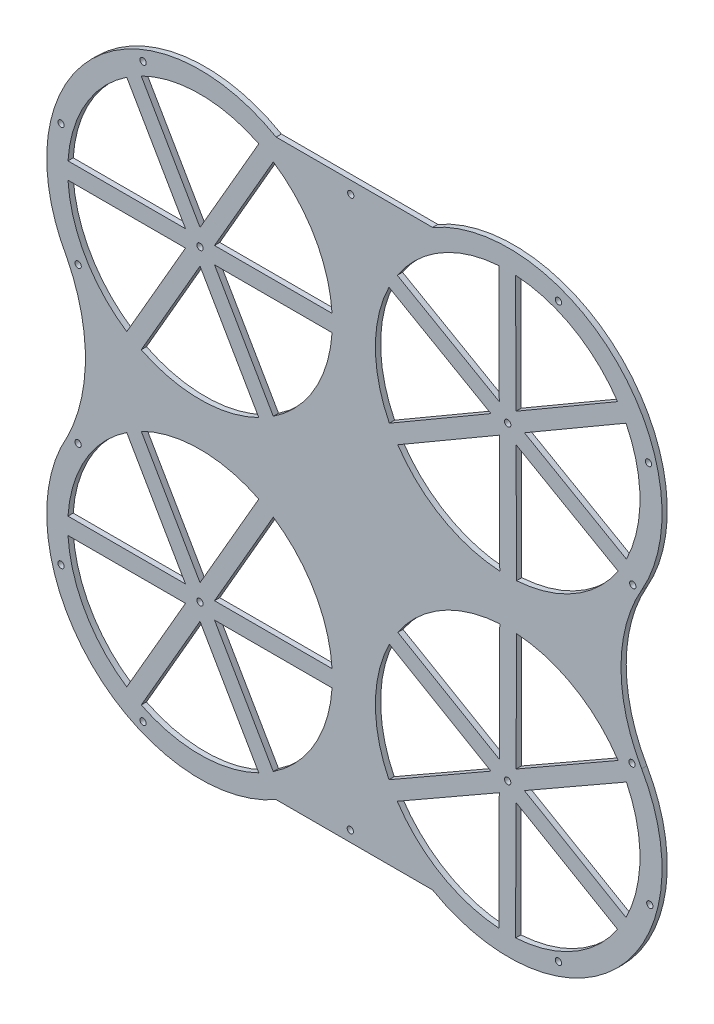
from build123d import *

# Parameters (mm, degrees)
MODEL_R         = 3
MODEL_R_2       = 2.999999999
EXTRUDE_1_DEPTH = 5


with BuildPart() as part:
    # Model → 凸台-拉伸1 (new body)
    with BuildSketch(Plane.XY):
        with BuildLine():
            Line((1801.04667122, 3384.62585133), (1652.053473941, 3384.62585133))
            ThreePointArc((1652.053473941, 3384.62585133), (1476.211681089, 3361.037418459), (1452.966845602, 3185.14987512))
            ThreePointArc((1452.966845602, 3185.14987512), (1470.408197338, 3111.400724011), (1452.966841198, 3037.651573943))
            ThreePointArc((1452.966841198, 3037.651573943), (1476.211684212, 2861.76403514), (1652.053473941, 2838.175605395))
            Line((1652.053473941, 2838.175605395), (1801.04667122, 2838.175605395))
            ThreePointArc((1801.04667122, 2838.175605395), (1976.888464071, 2861.764038266), (2000.13329956, 3037.651581604))
            ThreePointArc((2000.13329956, 3037.651581604), (1980.450087896, 3111.400728363), (2000.13329956, 3185.149875122))
            ThreePointArc((2000.13329956, 3185.149875122), (1976.888464071, 3361.037418459), (1801.04667122, 3384.62585133))
        make_face()
        with Locations((1463.462548046, 3185.149875121)):
            Circle(MODEL_R, mode=Mode.SUBTRACT)
        with Locations((1447.208426339, 3293.322313167)):
            Circle(MODEL_R, mode=Mode.SUBTRACT)
        with Locations((1525.324154834, 3383.712293191)):
            Circle(MODEL_R, mode=Mode.SUBTRACT)
        with Locations((1463.462548046, 3037.651582732)):
            Circle(MODEL_R, mode=Mode.SUBTRACT)
        with Locations((1447.208426339, 2929.479144686)):
            Circle(MODEL_R, mode=Mode.SUBTRACT)
        with Locations((1525.324154834, 2839.089164661)):
            Circle(MODEL_R, mode=Mode.SUBTRACT)
        with Locations((1991.691967871, 3185.149875121)):
            Circle(MODEL_R, mode=Mode.SUBTRACT)
        with Locations((2006.622075137, 3293.322313167)):
            Circle(MODEL_R, mode=Mode.SUBTRACT)
        with Locations((1920.899822368, 3383.712293191)):
            Circle(MODEL_R, mode=Mode.SUBTRACT)
        with Locations((1990.992539788, 3037.651582732)):
            Circle(MODEL_R, mode=Mode.SUBTRACT)
        with Locations((2007.92983358, 2929.479144686)):
            Circle(MODEL_R, mode=Mode.SUBTRACT)
        with Locations((1920.899822368, 2839.089164661)):
            Circle(MODEL_R, mode=Mode.SUBTRACT)
        with Locations((1723.111988601, 3372.896838033)):
            Circle(MODEL_R, mode=Mode.SUBTRACT)
        with Locations((1722.6694561, 2848.467983232)):
            Circle(MODEL_R, mode=Mode.SUBTRACT)
        with Locations((1579.55007258, 3257.900728363)):
            Circle(MODEL_R, mode=Mode.SUBTRACT)
        with Locations((1579.550072582, 2964.900728364)):
            Circle(MODEL_R_2, mode=Mode.SUBTRACT)
        with Locations((1872.548395989, 2963.902434755)):
            Circle(MODEL_R, mode=Mode.SUBTRACT)
        with Locations((1872.548395989, 3258.899021971)):
            Circle(MODEL_R, mode=Mode.SUBTRACT)
        with BuildLine():
            Line((1523.580291982, 3370.78732482), (1579.55007258, 3273.844821135))
            Line((1579.55007258, 3273.844821135), (1635.519853179, 3370.78732482))
            ThreePointArc((1635.519853179, 3370.78732482), (1579.55007258, 3383.900728363), (1523.580291982, 3370.78732482))
        make_face(mode=Mode.SUBTRACT)
        with BuildLine():
            Line((1509.772302601, 3362.815278434), (1565.742083199, 3265.872774749))
            Line((1565.742083199, 3265.872774749), (1453.802522002, 3265.872774749))
            ThreePointArc((1453.802522002, 3265.872774749), (1470.430871704, 3320.900728363), (1509.772302601, 3362.815278434))
        make_face(mode=Mode.SUBTRACT)
        with BuildLine():
            Line((1579.55007258, 3241.956635591), (1635.519853179, 3145.014131905))
            ThreePointArc((1635.519853179, 3145.014131905), (1579.55007258, 3131.900728363), (1523.580291982, 3145.014131905))
            Line((1523.580291982, 3145.014131905), (1579.55007258, 3241.956635591))
        make_face(mode=Mode.SUBTRACT)
        with BuildLine():
            Line((1593.358061961, 3249.928681977), (1649.32784256, 3152.986178291))
            ThreePointArc((1649.32784256, 3152.986178291), (1688.669273457, 3194.900728363), (1705.297623159, 3249.928681977))
            Line((1705.297623159, 3249.928681977), (1593.358061961, 3249.928681977))
        make_face(mode=Mode.SUBTRACT)
        with BuildLine():
            Line((1453.802522002, 3249.928681977), (1565.742083199, 3249.928681977))
            Line((1565.742083199, 3249.928681977), (1509.772302601, 3152.986178291))
            ThreePointArc((1509.772302601, 3152.986178291), (1470.430871704, 3194.900728363), (1453.802522002, 3249.928681977))
        make_face(mode=Mode.SUBTRACT)
        with BuildLine():
            Line((1649.32784256, 3362.815278434), (1593.358061961, 3265.872774749))
            Line((1593.358061961, 3265.872774749), (1705.297623159, 3265.872774749))
            ThreePointArc((1705.297623159, 3265.872774749), (1688.669273457, 3320.900728363), (1649.32784256, 3362.815278434))
        make_face(mode=Mode.SUBTRACT)
        with BuildLine():
            Line((1509.772302601, 2859.986179418), (1565.742083199, 2956.928683103))
            Line((1565.742083199, 2956.928683103), (1453.802522002, 2956.928683103))
            ThreePointArc((1453.802522002, 2956.928683103), (1470.430871328, 2901.900729155), (1509.772302601, 2859.986179418))
        make_face(mode=Mode.SUBTRACT)
        with BuildLine():
            Line((1579.55007258, 2980.844822261), (1635.519853179, 3077.787325947))
            ThreePointArc((1635.519853179, 3077.787325947), (1579.55007258, 3090.900729372), (1523.580291982, 3077.787325947))
            Line((1523.580291982, 3077.787325947), (1579.55007258, 2980.844822261))
        make_face(mode=Mode.SUBTRACT)
        with BuildLine():
            Line((1523.580291982, 2852.014133032), (1579.55007258, 2948.956636717))
            Line((1579.55007258, 2948.956636717), (1635.519853179, 2852.014133032))
            ThreePointArc((1635.519853179, 2852.014133032), (1579.55007258, 2838.900729372), (1523.580291982, 2852.014133032))
        make_face(mode=Mode.SUBTRACT)
        with BuildLine():
            Line((1593.358061961, 2972.872775875), (1649.32784256, 3069.815279561))
            ThreePointArc((1649.32784256, 3069.815279561), (1688.669273082, 3027.900729155), (1705.297623159, 2972.872775875))
            Line((1705.297623159, 2972.872775875), (1593.358061961, 2972.872775875))
        make_face(mode=Mode.SUBTRACT)
        with BuildLine():
            Line((1453.802522002, 2972.872775875), (1565.742083199, 2972.872775875))
            Line((1565.742083199, 2972.872775875), (1509.772302601, 3069.815279561))
            ThreePointArc((1509.772302601, 3069.815279561), (1470.430871329, 3027.900729588), (1453.802522002, 2972.872775875))
        make_face(mode=Mode.SUBTRACT)
        with BuildLine():
            Line((1649.32784256, 2859.986179418), (1593.358061961, 2956.928683103))
            Line((1593.358061961, 2956.928683103), (1705.297623159, 2956.928683103))
            ThreePointArc((1705.297623159, 2956.928683103), (1688.669273083, 2901.900729588), (1649.32784256, 2859.986179418))
        make_face(mode=Mode.SUBTRACT)
        with BuildLine():
            Line((1977.224599856, 2893.767619263), (1880.473351412, 2950.06736425))
            Line((1880.473351412, 2950.06736425), (1880.091966249, 2838.128452757))
            ThreePointArc((1880.091966249, 2838.128452757), (1935.176254316, 2854.569222229), (1977.224599856, 2893.767619263))
        make_face(mode=Mode.SUBTRACT)
        with BuildLine():
            Line((1856.604395758, 2963.956757288), (1759.853147314, 3020.256502275))
            ThreePointArc((1759.853147314, 3020.256502275), (1746.5491273, 2964.331724723), (1759.47176215, 2908.317590781))
            Line((1759.47176215, 2908.317590781), (1856.604395758, 2963.956757288))
        make_face(mode=Mode.SUBTRACT)
        with BuildLine():
            Line((1985.243644665, 2907.548367236), (1888.492396221, 2963.848112223))
            Line((1888.492396221, 2963.848112223), (1985.625029828, 3019.487278729))
            ThreePointArc((1985.625029828, 3019.487278729), (1998.547664678, 2963.473144788), (1985.243644665, 2907.548367236))
        make_face(mode=Mode.SUBTRACT)
        with BuildLine():
            Line((1864.623440566, 2977.73750526), (1767.872192123, 3034.037250247))
            ThreePointArc((1767.872192123, 3034.037250247), (1809.920537662, 3073.235647282), (1865.00482573, 3089.676416754))
            Line((1865.00482573, 3089.676416754), (1864.623440566, 2977.73750526))
        make_face(mode=Mode.SUBTRACT)
        with BuildLine():
            Line((1864.147966017, 2838.182775289), (1864.52935118, 2950.121686783))
            Line((1864.52935118, 2950.121686783), (1767.396717573, 2894.482520276))
            ThreePointArc((1767.396717573, 2894.482520276), (1809.176985627, 2854.998512196), (1864.147966017, 2838.182775289))
        make_face(mode=Mode.SUBTRACT)
        with BuildLine():
            Line((1977.700074405, 3033.322349234), (1880.567440798, 2977.683182728))
            Line((1880.567440798, 2977.683182728), (1880.948825962, 3089.622094221))
            ThreePointArc((1880.948825962, 3089.622094221), (1935.919806351, 3072.806357314), (1977.700074405, 3033.322349234))
        make_face(mode=Mode.SUBTRACT)
        with BuildLine():
            Line((1977.224599856, 3329.033837463), (1880.473351412, 3272.734092476))
            Line((1880.473351412, 3272.734092476), (1880.091966249, 3384.673003969))
            ThreePointArc((1880.091966249, 3384.673003969), (1935.176254316, 3368.232234498), (1977.224599856, 3329.033837463))
        make_face(mode=Mode.SUBTRACT)
        with BuildLine():
            Line((1856.604395758, 3258.844699439), (1759.853147314, 3202.544954452))
            ThreePointArc((1759.853147314, 3202.544954452), (1746.5491273, 3258.469732003), (1759.47176215, 3314.483865945))
            Line((1759.47176215, 3314.483865945), (1856.604395758, 3258.844699439))
        make_face(mode=Mode.SUBTRACT)
        with BuildLine():
            Line((1985.243644665, 3315.25308949), (1888.492396221, 3258.953344503))
            Line((1888.492396221, 3258.953344503), (1985.625029828, 3203.314177997))
            ThreePointArc((1985.625029828, 3203.314177997), (1998.547664678, 3259.328311939), (1985.243644665, 3315.25308949))
        make_face(mode=Mode.SUBTRACT)
        with BuildLine():
            Line((1864.623440566, 3245.063951466), (1767.872192123, 3188.764206479))
            ThreePointArc((1767.872192123, 3188.764206479), (1809.920537662, 3149.565809444), (1865.00482573, 3133.125039973))
            Line((1865.00482573, 3133.125039973), (1864.623440566, 3245.063951466))
        make_face(mode=Mode.SUBTRACT)
        with BuildLine():
            Line((1864.147966017, 3384.618681437), (1864.52935118, 3272.679769944))
            Line((1864.52935118, 3272.679769944), (1767.396717573, 3328.31893645))
            ThreePointArc((1767.396717573, 3328.31893645), (1809.176985627, 3367.80294453), (1864.147966017, 3384.618681437))
        make_face(mode=Mode.SUBTRACT)
        with BuildLine():
            Line((1977.700074405, 3189.479107492), (1880.567440798, 3245.118273999))
            Line((1880.567440798, 3245.118273999), (1880.948825962, 3133.179362505))
            ThreePointArc((1880.948825962, 3133.179362505), (1935.919806351, 3149.995099412), (1977.700074405, 3189.479107492))
        make_face(mode=Mode.SUBTRACT)
    extrude(amount=EXTRUDE_1_DEPTH)


solid = part.part
